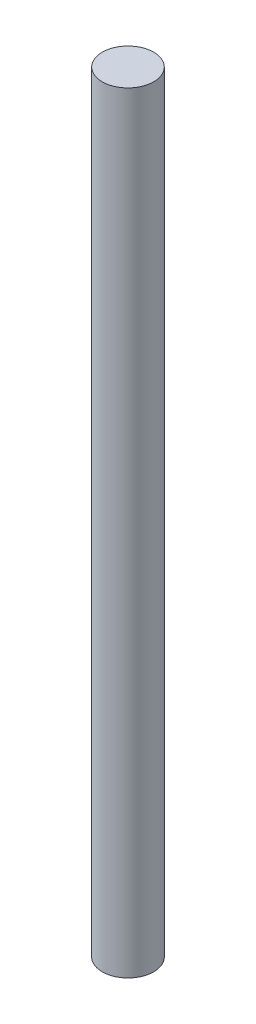
from build123d import *

# Parameters (mm, degrees)
SKETCH2_R           = 4
BOSS_EXTRUDE1_DEPTH = 120


with BuildPart() as part:
    # Sketch2 → Boss-Extrude1 (new body)
    with BuildSketch(Plane(origin=(0, 0, 0), x_dir=(1, 0, 0), z_dir=(0, 1, 0))):
        with Locations(Location((0, 0, 0), (0, 0, 270))):
            Circle(SKETCH2_R)
    extrude(amount=BOSS_EXTRUDE1_DEPTH)


solid = part.part
